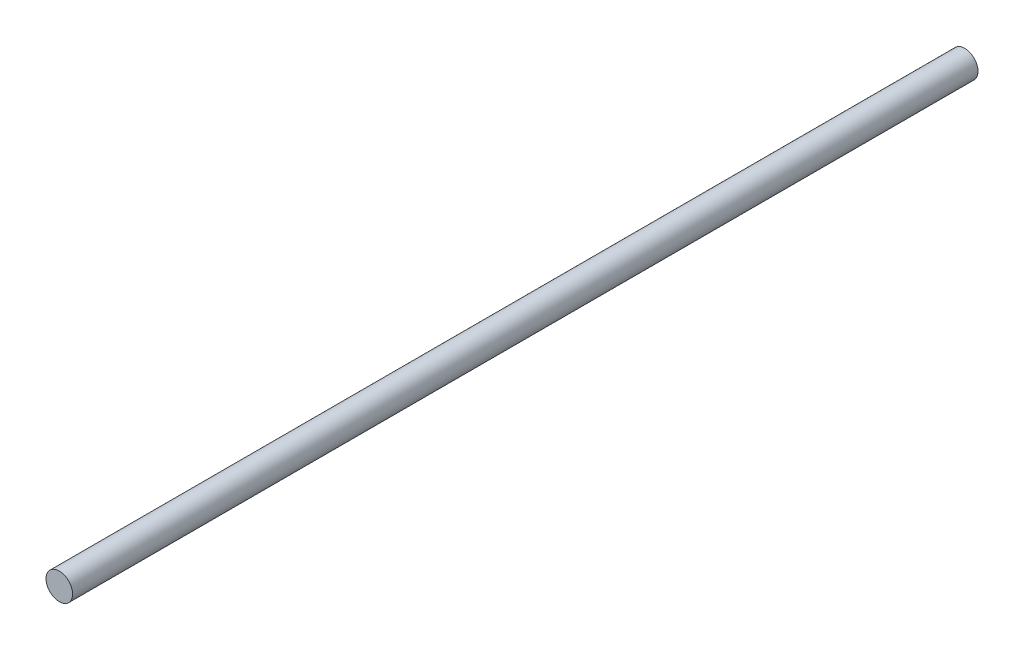
from build123d import *

# Parameters (mm, degrees)
SKETCH1_R           = 6.35
BOSS_EXTRUDE1_DEPTH = 432.562


with BuildPart() as part:
    # Sketch1 → Boss-Extrude1 (new body)
    with BuildSketch(Plane.XY):
        with Locations(Location((0, 0, 0), (0, 0, 180))):
            Circle(SKETCH1_R)
    extrude(amount=BOSS_EXTRUDE1_DEPTH)


solid = part.part
